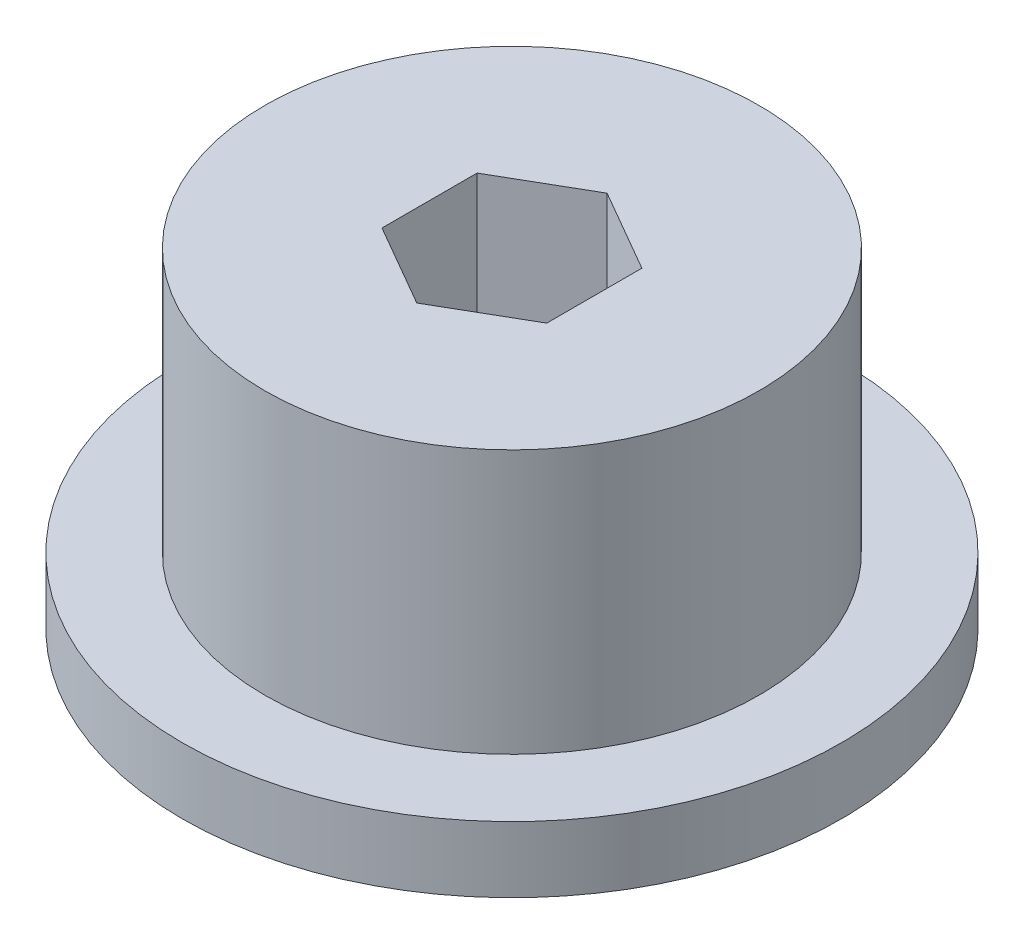
from build123d import *

# Parameters (mm, degrees)
SKETCH1_R           = 10
BOSS_EXTRUDE1_DEPTH = 2
SKETCH2_R           = 7.5
BOSS_EXTRUDE2_DEPTH = 8
CUT_EXTRUDE2_REACH  = 19.321


with BuildPart() as part:
    # Sketch1 → Boss-Extrude1 (new body)
    with BuildSketch(Plane(origin=(0, 0, 0), x_dir=(1, 0, 0), z_dir=(0, 1, 0))):
        with Locations(Location((0, 0, 0), (0, 0, 270))):
            Circle(SKETCH1_R)
    extrude(amount=BOSS_EXTRUDE1_DEPTH)

    # Sketch2 → Boss-Extrude2 (add)
    with BuildSketch(Plane(origin=(0, 2, 0), x_dir=(1, 0, 0), z_dir=(0, 1, 0))):
        with Locations(Location((0, 0, 0), (0, 0, 270))):
            Circle(SKETCH2_R)
    extrude(amount=BOSS_EXTRUDE2_DEPTH)

    # Sketch4 → Cut-Extrude2 (cut, up to next)
    with BuildSketch(Plane(origin=(0, 10, 0), x_dir=(1, 0, 0), z_dir=(0, 1, 0)), mode=Mode.PRIVATE) as cut_extrude2_sk1:
        Polygon((2.5, 1.443375673), (0, 2.886751346), (-2.5, 1.443375673), (-2.5, -1.443375673), (0, -2.886751346), (2.5, -1.443375673), align=None)
    cut_extrude2_tool1 = extrude(cut_extrude2_sk1.sketch, amount=-CUT_EXTRUDE2_REACH, mode=Mode.PRIVATE) & part.part
    add(cut_extrude2_tool1.solids().sort_by_distance((0, 10, 0))[0], mode=Mode.SUBTRACT)


solid = part.part
